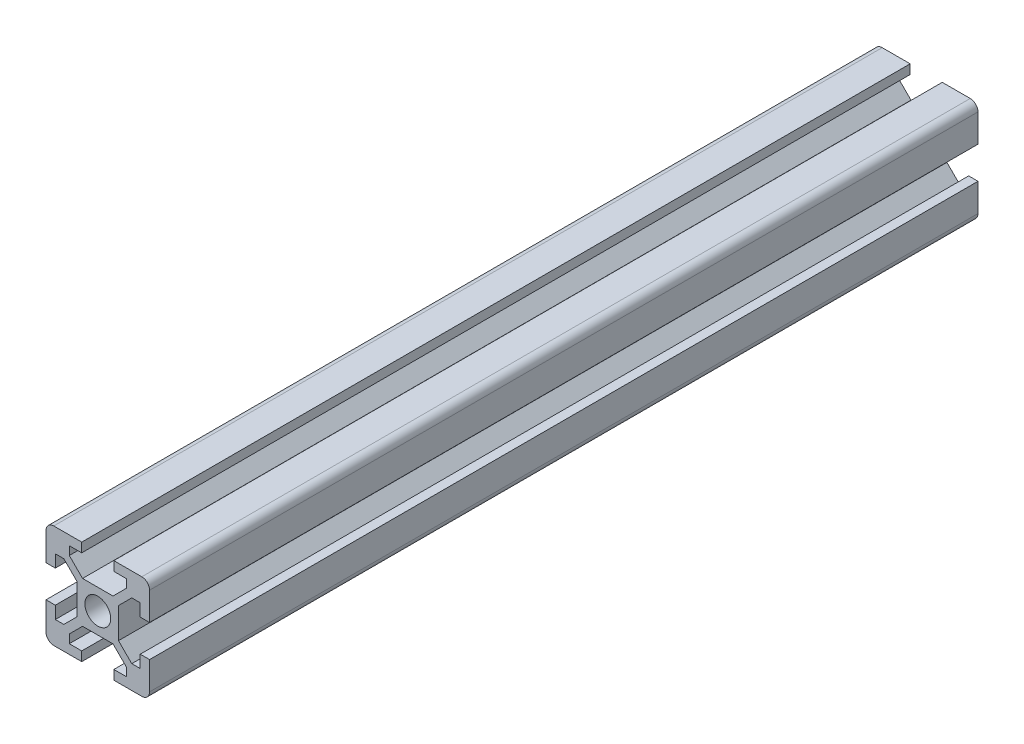
from build123d import *

# Parameters (mm, degrees)
SKETCH_1_R      = 2.5
EXTRUDE_2_DEPTH = 160
SCALE1_SCALE    = 2.5


with BuildPart() as part:
    # 草图1 → 凸台-拉伸2 (new body)
    with BuildSketch(Plane.XY):
        with BuildLine():
            Line((5.5, -8.2), (5.5, -6.560660172))
            Line((5.5, -6.560660172), (2.939339828, -4))
            Line((2.939339828, -4), (-2.939339828, -4))
            Line((-2.939339828, -4), (-5.5, -6.560660172))
            Line((-5.5, -6.560660172), (-5.5, -8.2))
            Line((-5.5, -8.2), (-3.1, -8.2))
            Line((-3.1, -8.2), (-3.1, -10))
            Line((-3.1, -10), (-8.5, -10))
            ThreePointArc((-8.5, -10), (-9.560660172, -9.560660172), (-10, -8.5))
            Line((-10, -8.5), (-10, -3.1))
            Line((-10, -3.1), (-8.2, -3.1))
            Line((-8.2, -3.1), (-8.2, -5.5))
            Line((-8.2, -5.5), (-6.560660172, -5.5))
            Line((-6.560660172, -5.5), (-4, -2.939339828))
            Line((-4, -2.939339828), (-4, 2.939339828))
            Line((-4, 2.939339828), (-6.560660172, 5.5))
            Line((-6.560660172, 5.5), (-8.2, 5.5))
            Line((-8.2, 5.5), (-8.2, 3.1))
            Line((-8.2, 3.1), (-10, 3.1))
            Line((-10, 3.1), (-10, 8.5))
            ThreePointArc((-10, 8.5), (-9.560660172, 9.560660172), (-8.5, 10))
            Line((-8.5, 10), (-3.1, 10))
            Line((-3.1, 10), (-3.1, 8.2))
            Line((-3.1, 8.2), (-5.5, 8.2))
            Line((-5.5, 8.2), (-5.5, 6.560660172))
            Line((-5.5, 6.560660172), (-2.939339828, 4))
            Line((-2.939339828, 4), (2.939339828, 4))
            Line((2.939339828, 4), (5.5, 6.560660172))
            Line((5.5, 6.560660172), (5.5, 8.2))
            Line((5.5, 8.2), (3.1, 8.2))
            Line((3.1, 8.2), (3.1, 10))
            Line((3.1, 10), (8.5, 10))
            ThreePointArc((8.5, 10), (9.560660172, 9.560660172), (10, 8.5))
            Line((10, 8.5), (10, 3.1))
            Line((10, 3.1), (8.2, 3.1))
            Line((8.2, 3.1), (8.2, 5.5))
            Line((8.2, 5.5), (6.560660172, 5.5))
            Line((6.560660172, 5.5), (4, 2.939339828))
            Line((4, 2.939339828), (4, -2.939339828))
            Line((4, -2.939339828), (6.560660172, -5.5))
            Line((6.560660172, -5.5), (8.2, -5.5))
            Line((8.2, -5.5), (8.2, -3.1))
            Line((8.2, -3.1), (10, -3.1))
            Line((10, -3.1), (10, -8.5))
            ThreePointArc((10, -8.5), (9.560660172, -9.560660172), (8.5, -10))
            Line((8.5, -10), (3.1, -10))
            Line((3.1, -10), (3.1, -8.2))
            Line((3.1, -8.2), (5.5, -8.2))
        make_face()
        Circle(SKETCH_1_R, mode=Mode.SUBTRACT)
    extrude(amount=-EXTRUDE_2_DEPTH)


with BuildPart() as part_1:
    # Scale1: scaled about (0, 0, 0)
    add(part.part.scale(SCALE1_SCALE))


solid = part_1.part
